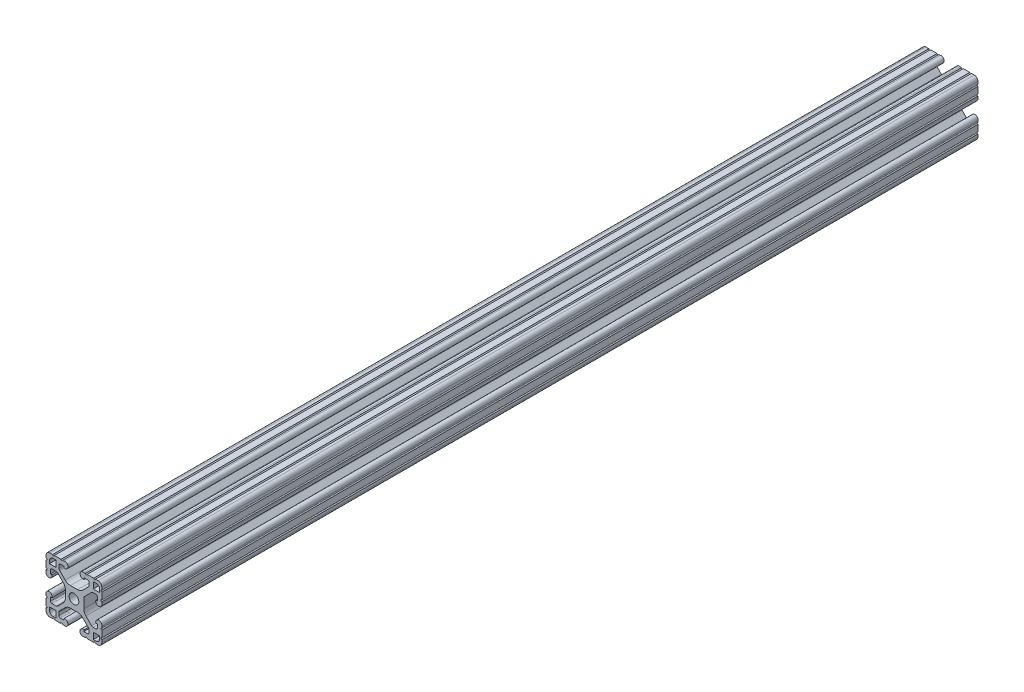
from build123d import *

# Parameters (mm, degrees)
SKETCH1_R           = 3.3274
BOSS_EXTRUDE1_DEPTH = 600


with BuildPart() as part:
    # Sketch1 → Boss-Extrude1 (new body)
    with BuildSketch(Plane.XY):
        with BuildLine():
            Line((-13.26278249, 12.048382599), (-9.466223312, 8.222017216))
            ThreePointArc((-9.466223312, 8.222017216), (-7.839336885, 7.128051946), (-5.916892336, 6.7437))
            Line((-5.916892336, 6.7437), (-0.938351009, 6.7437))
            ThreePointArc((-0.938351009, 6.7437), (0.975066153, 7.124302337), (2.597182897, 8.208166094))
            Line((2.597182897, 8.208166094), (6.436676974, 12.047660172))
            ThreePointArc((6.436676974, 12.047660172), (6.761836101, 12.534295195), (6.876016803, 13.108320344))
            Line((6.876016803, 13.108320344), (6.876016803, 14.986))
            ThreePointArc((6.876016803, 14.986), (6.583123584, 15.693106781), (5.876016803, 15.986))
            Line((5.876016803, 15.986), (3.390016803, 15.986))
            Line((3.390016803, 15.986), (3.390016803, 14.986))
            ThreePointArc((3.390016803, 14.986), (0.690016803, 17.018), (3.390016803, 19.05))
            Line((3.390016803, 19.05), (4.390016803, 19.05))
            ThreePointArc((4.390016803, 19.05), (4.972748366, 18.467268437), (5.555479929, 19.05))
            Line((5.555479929, 19.05), (10.055479929, 19.05))
            ThreePointArc((10.055479929, 19.05), (10.648750347, 18.456729582), (11.242020765, 19.05))
            Line((11.242020765, 19.05), (13.081716803, 19.05))
            ThreePointArc((13.081716803, 19.05), (14.849483756, 18.317766953), (15.581716803, 16.55))
            Line((15.581716803, 16.55), (15.581716803, 14.701887799))
            ThreePointArc((15.581716803, 14.701887799), (14.98781258, 14.107983576), (15.581716803, 13.514079353))
            Line((15.581716803, 13.514079353), (15.581716803, 9.000407261))
            ThreePointArc((15.581716803, 9.000407261), (14.977014321, 8.39570478), (15.581716803, 7.791002299))
            Line((15.581716803, 7.791002299), (15.581716803, 6.801))
            ThreePointArc((15.581716803, 6.801), (13.549716803, 4.101), (11.517716803, 6.801))
            Line((11.517716803, 6.801), (12.517716803, 6.801))
            Line((12.517716803, 6.801), (12.517716803, 9.287))
            ThreePointArc((12.517716803, 9.287), (12.224823584, 9.994106781), (11.517716803, 10.287))
            Line((11.517716803, 10.287), (9.640037146, 10.287))
            ThreePointArc((9.640037146, 10.287), (9.066011998, 10.172819299), (8.579376974, 9.847660172))
            Line((8.579376974, 9.847660172), (3.275416803, 4.5437))
            Line((3.275416803, 4.5437), (3.275416803, -2.472632188))
            ThreePointArc((3.275416803, -2.472632188), (3.65601914, -4.38604935), (4.739882897, -6.008166094))
            Line((4.739882897, -6.008166094), (8.579376974, -9.847660172))
            ThreePointArc((8.579376974, -9.847660172), (9.066011998, -10.172819299), (9.640037146, -10.287))
            Line((9.640037146, -10.287), (11.517716803, -10.287))
            ThreePointArc((11.517716803, -10.287), (12.224823584, -9.994106781), (12.517716803, -9.287))
            Line((12.517716803, -9.287), (12.517716803, -6.801))
            Line((12.517716803, -6.801), (11.517716803, -6.801))
            ThreePointArc((11.517716803, -6.801), (13.549716803, -4.101), (15.581716803, -6.801))
            Line((15.581716803, -6.801), (15.581716803, -7.784900507))
            ThreePointArc((15.581716803, -7.784900507), (14.976944942, -8.389672368), (15.581716803, -8.994444229))
            Line((15.581716803, -8.994444229), (15.581716803, -13.530233187))
            ThreePointArc((15.581716803, -13.530233187), (14.961825645, -14.150124345), (15.581716803, -14.770015502))
            Line((15.581716803, -14.770015502), (15.581716803, -16.55))
            ThreePointArc((15.581716803, -16.55), (14.849483756, -18.317766953), (13.081716803, -19.05))
            Line((13.081716803, -19.05), (11.242020765, -19.05))
            ThreePointArc((11.242020765, -19.05), (10.648750347, -18.456729582), (10.055479929, -19.05))
            Line((10.055479929, -19.05), (5.555479929, -19.05))
            ThreePointArc((5.555479929, -19.05), (4.944098366, -18.438618437), (4.332716803, -19.05))
            Line((4.332716803, -19.05), (3.332716803, -19.05))
            ThreePointArc((3.332716803, -19.05), (0.632716803, -17.018), (3.332716803, -14.986))
            Line((3.332716803, -14.986), (3.332716803, -15.986))
            Line((3.332716803, -15.986), (5.818716803, -15.986))
            ThreePointArc((5.818716803, -15.986), (6.525823584, -15.693106781), (6.818716803, -14.986))
            Line((6.818716803, -14.986), (6.818716803, -13.108320344))
            ThreePointArc((6.818716803, -13.108320344), (6.704536101, -12.534295195), (6.379376974, -12.047660172))
            Line((6.379376974, -12.047660172), (2.539882897, -8.208166094))
            ThreePointArc((2.539882897, -8.208166094), (0.917766153, -7.124302337), (-0.995651009, -6.7437))
            Line((-0.995651009, -6.7437), (-5.974192336, -6.7437))
            ThreePointArc((-5.974192336, -6.7437), (-7.896636885, -7.128051946), (-9.523523312, -8.222017216))
            Line((-9.523523312, -8.222017216), (-13.32008249, -12.048382599))
            ThreePointArc((-13.32008249, -12.048382599), (-13.642222082, -12.533572695), (-13.755283197, -13.104887434))
            Line((-13.755283197, -13.104887434), (-13.755283197, -14.986))
            ThreePointArc((-13.755283197, -14.986), (-13.462389979, -15.693106781), (-12.755283197, -15.986))
            Line((-12.755283197, -15.986), (-10.269283197, -15.986))
            Line((-10.269283197, -15.986), (-10.269283197, -14.986))
            ThreePointArc((-10.269283197, -14.986), (-7.569283197, -17.018), (-10.269283197, -19.05))
            Line((-10.269283197, -19.05), (-11.315016833, -19.05))
            ThreePointArc((-11.315016833, -19.05), (-11.921258393, -18.44375844), (-12.527499953, -19.05))
            Line((-12.527499953, -19.05), (-16.98793888, -19.05))
            ThreePointArc((-16.98793888, -19.05), (-17.564834103, -18.473104777), (-18.141729326, -19.05))
            Line((-18.141729326, -19.05), (-20.018283197, -19.05))
            ThreePointArc((-20.018283197, -19.05), (-21.78605015, -18.317766953), (-22.518283197, -16.55))
            Line((-22.518283197, -16.55), (-22.518283197, -14.770015502))
            ThreePointArc((-22.518283197, -14.770015502), (-21.89839204, -14.150124345), (-22.518283197, -13.530233187))
            Line((-22.518283197, -13.530233187), (-22.518283197, -8.994444229))
            ThreePointArc((-22.518283197, -8.994444229), (-21.913511336, -8.389672368), (-22.518283197, -7.784900507))
            Line((-22.518283197, -7.784900507), (-22.518283197, -6.801))
            ThreePointArc((-22.518283197, -6.801), (-20.486283197, -4.101), (-18.454283197, -6.801))
            Line((-18.454283197, -6.801), (-19.454283197, -6.801))
            Line((-19.454283197, -6.801), (-19.454283197, -9.287))
            ThreePointArc((-19.454283197, -9.287), (-19.161389979, -9.994106781), (-18.454283197, -10.287))
            Line((-18.454283197, -10.287), (-15.690222352, -10.287))
            ThreePointArc((-15.690222352, -10.287), (-15.116197203, -10.172819299), (-14.62956218, -9.847660172))
            Line((-14.62956218, -9.847660172), (-10.790068102, -6.008166094))
            ThreePointArc((-10.790068102, -6.008166094), (-9.706204346, -4.38604935), (-9.325602008, -2.472632188))
            Line((-9.325602008, -2.472632188), (-9.325602008, 2.472632188))
            ThreePointArc((-9.325602008, 2.472632188), (-9.706204346, 4.38604935), (-10.790068102, 6.008166094))
            Line((-10.790068102, 6.008166094), (-14.62956218, 9.847660172))
            ThreePointArc((-14.62956218, 9.847660172), (-15.116197203, 10.172819299), (-15.690222352, 10.287))
            Line((-15.690222352, 10.287), (-18.470283197, 10.287))
            ThreePointArc((-18.470283197, 10.287), (-19.177389979, 9.994106781), (-19.470283197, 9.287))
            Line((-19.470283197, 9.287), (-19.470283197, 6.801))
            Line((-19.470283197, 6.801), (-18.454283197, 6.801))
            ThreePointArc((-18.454283197, 6.801), (-20.486283197, 4.101), (-22.518283197, 6.801))
            Line((-22.518283197, 6.801), (-22.518283197, 7.791002299))
            ThreePointArc((-22.518283197, 7.791002299), (-21.913580716, 8.39570478), (-22.518283197, 9.000407261))
            Line((-22.518283197, 9.000407261), (-22.518283197, 13.514079353))
            ThreePointArc((-22.518283197, 13.514079353), (-21.924378975, 14.107983576), (-22.518283197, 14.701887799))
            Line((-22.518283197, 14.701887799), (-22.518283197, 16.55))
            ThreePointArc((-22.518283197, 16.55), (-21.78605015, 18.317766953), (-20.018283197, 19.05))
            Line((-20.018283197, 19.05), (-18.058059148, 19.05))
            ThreePointArc((-18.058059148, 19.05), (-17.472421173, 18.464362025), (-16.886783197, 19.05))
            Line((-16.886783197, 19.05), (-12.338361419, 19.05))
            ThreePointArc((-12.338361419, 19.05), (-11.7540173, 18.465655881), (-11.169673181, 19.05))
            Line((-11.169673181, 19.05), (-10.211983197, 19.05))
            ThreePointArc((-10.211983197, 19.05), (-7.511983197, 17.018), (-10.211983197, 14.986))
            Line((-10.211983197, 14.986), (-10.211983197, 15.986))
            Line((-10.211983197, 15.986), (-12.697983197, 15.986))
            ThreePointArc((-12.697983197, 15.986), (-13.405089979, 15.693106781), (-13.697983197, 14.986))
            Line((-13.697983197, 14.986), (-13.697983197, 13.104887434))
            ThreePointArc((-13.697983197, 13.104887434), (-13.584922082, 12.533572695), (-13.26278249, 12.048382599))
        make_face()
        with Locations((-3.468283197, 0)):
            Circle(SKETCH1_R, mode=Mode.SUBTRACT)
        with BuildLine():
            Line((14.158897896, 12.521284057), (14.158897896, 14.421284057))
            ThreePointArc((14.158897896, 14.421284057), (13.426664849, 16.189051009), (11.658897896, 16.921284057))
            Line((11.658897896, 16.921284057), (9.758897896, 16.921284057))
            Line((9.758897896, 16.921284057), (9.758897896, 12.521284057))
            Line((9.758897896, 12.521284057), (14.158897896, 12.521284057))
        make_face(mode=Mode.SUBTRACT)
        with BuildLine():
            Line((-15.841102104, 12.521284057), (-20.241102104, 12.521284057))
            Line((-20.241102104, 12.521284057), (-20.241102104, 14.421284057))
            ThreePointArc((-20.241102104, 14.421284057), (-19.508869057, 16.189051009), (-17.741102104, 16.921284057))
            Line((-17.741102104, 16.921284057), (-15.841102104, 16.921284057))
            Line((-15.841102104, 16.921284057), (-15.841102104, 12.521284057))
        make_face(mode=Mode.SUBTRACT)
        with BuildLine():
            Line((-15.841102104, -17.478715943), (-15.841102104, -13.078715943))
            Line((-15.841102104, -13.078715943), (-20.241102104, -13.078715943))
            Line((-20.241102104, -13.078715943), (-20.241102104, -14.978715943))
            ThreePointArc((-20.241102104, -14.978715943), (-19.508869057, -16.746482896), (-17.741102104, -17.478715943))
            Line((-17.741102104, -17.478715943), (-15.841102104, -17.478715943))
        make_face(mode=Mode.SUBTRACT)
        with BuildLine():
            Line((14.158897896, -14.978715943), (14.158897896, -13.078715943))
            Line((14.158897896, -13.078715943), (9.758897896, -13.078715943))
            Line((9.758897896, -13.078715943), (9.758897896, -17.478715943))
            Line((9.758897896, -17.478715943), (11.658897896, -17.478715943))
            ThreePointArc((11.658897896, -17.478715943), (13.426664849, -16.746482896), (14.158897896, -14.978715943))
        make_face(mode=Mode.SUBTRACT)
    extrude(amount=BOSS_EXTRUDE1_DEPTH)


solid = part.part
